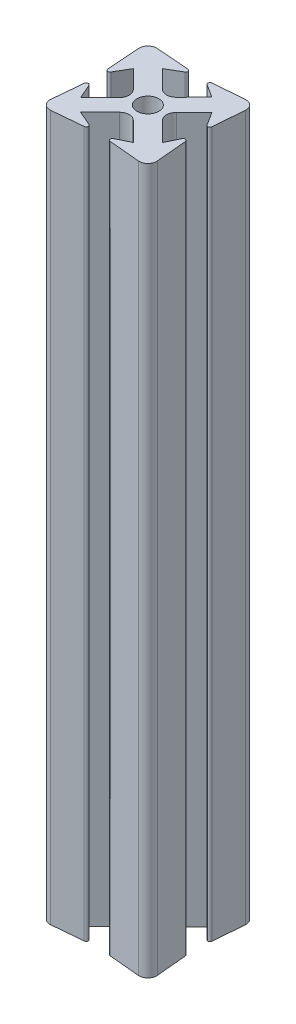
from build123d import *

# Parameters (mm, degrees)
BOSS_EXTRUDE1_DEPTH     = 603.25
SKETCH8_R               = 2.565266714
CUT_EXTRUDE4_DEPTH      = 604.996
FILLET1_R               = 2.032
FILLET2_R               = 0.508
SKETCH5_W               = 12.655737404
SKETCH5_H               = 275.477439744
BOSS_EXTRUDE3_DEPTH     = 4.572
SKETCH6_R               = 4.617709461
SKETCH6_R_2             = 4.503643825
SKETCH6_R_3             = 4.621904919
SKETCH6_R_4             = 4.672748293
SKETCH6_R_5             = 4.615964847
CUT_EXTRUDE2_DEPTH      = 4.572
SKETCH7_R               = 4.54487388
SKETCH7_R_2             = 4.672668652
CUT_EXTRUDE3_DEPTH      = 4.572
FILLET3_R               = 2.286
CUT_EXTRUDE6_DEPTH      = 10.922
CUT_EXTRUDE6_DEPTH_BACK = 38.354
SKETCH9_W               = 60.400846089
SKETCH9_H               = 376.70446786
CUT_EXTRUDE7_DEPTH      = 11.938
CUT_EXTRUDE7_DEPTH_BACK = 33.274
SKETCH10_W              = 57.705662998
SKETCH10_H              = 86.678631682


with BuildPart() as part:
    # Sketch2 → Boss-Extrude1 (new body)
    with BuildSketch(Plane(origin=(0, 0, 0), x_dir=(1, 0, 0), z_dir=(0, 1, 0))):
        Polygon((-16.258611825, -14.593573265), (-15.211300169, -2.97584616), (-12.901409331, -8.316313776), (2.370242199, 7.164742979), (-1.981461576, 9.939777323), (9.141388175, 10.806426735), (8.274738763, -0.316423015), (5.499704418, 4.03528076), (-9.981352337, -11.236370771), (-4.640884721, -13.546261608), align=None)
        Polygon((-15.391962413, -0.962649654), (-12.616928069, 3.750799497), (2.370242199, -11.236370771), (-2.346798037, -13.546261608), (9.141388175, -14.593573265), (8.094076519, -3.105387053), (5.784185681, -7.822427289), (-9.202984587, 7.164742979), (-4.489535436, 9.939777323), (-16.258611825, 10.806426735), align=None)
    extrude(amount=BOSS_EXTRUDE1_DEPTH)

    # Sketch8 → Cut-Extrude4 (cut)
    with BuildSketch(Plane(origin=(0, 603.25, 0), x_dir=(1, 0, 0), z_dir=(0, 1, 0))):
        with Locations(Location((-3.527048706, -1.915222876, 0), (0, 0, 270))):
            Circle(SKETCH8_R)
    extrude(amount=-CUT_EXTRUDE4_DEPTH, mode=Mode.SUBTRACT)

    # Fillet1
    fillet1_edges = [part.edges().sort_by_distance(p)[0] for p in [
        (9.141388175, 301.625, -10.806426735),
        (9.141388175, 301.625, 14.593573265),
        (-16.258611825, 301.625, 14.593573265),
        (-16.258611825, 301.625, -10.806426735),
    ]]
    fillet(fillet1_edges, radius=FILLET1_R)

    # Fillet2
    fillet2_edges = [part.edges().sort_by_distance(p)[0] for p in [
        (-1.981461576, 301.625, -9.939777323),
        (8.274738763, 301.625, 0.316423015),
        (8.094076519, 301.625, 3.105387053),
        (-2.346798037, 301.625, 13.546261608),
        (-4.640884721, 301.625, 13.546261608),
        (-15.211300169, 301.625, 2.97584616),
        (-15.391962413, 301.625, 0.962649654),
        (-4.489535436, 301.625, -9.939777323),
    ]]
    fillet(fillet2_edges, radius=FILLET2_R)

    # Sketch5 → Boss-Extrude3 (add)
    with BuildSketch(Plane(origin=(-0.781752329, 0, -10.033254025), x_dir=(-0.9969782897972478, 0, 0.07768069047681715), z_dir=(-0.07768069047681715, 0, -0.9969782897972478))):
        with Locations((2.46042797, 432.716085527)):
            Rectangle(SKETCH5_W, SKETCH5_H)
    extrude(amount=BOSS_EXTRUDE3_DEPTH)

    # Sketch6 → Cut-Extrude2 (cut)
    with BuildSketch(Plane(origin=(-1.136908446, 0, -14.591438766), x_dir=(-0.9969782897972478, 0, 0.07768069047681722), z_dir=(-0.07768069047681722, 0, -0.9969782897972478))):
        with Locations((2.46042797, 545.232588529)):
            Circle(SKETCH6_R)
        with Locations((2.46042797, 513.854170907)):
            Circle(SKETCH6_R_2)
        with Locations((2.46042797, 479.255100803)):
            Circle(SKETCH6_R_3)
        with Locations((2.46042797, 446.301604006)):
            Circle(SKETCH6_R_4)
        with Locations((2.46042797, 414.342225806)):
            Circle(SKETCH6_R_5)
    extrude(amount=-CUT_EXTRUDE2_DEPTH, mode=Mode.SUBTRACT)

    # Sketch7 → Cut-Extrude3 (cut)
    with BuildSketch(Plane(origin=(-1.136908446, 0, -14.591438766), x_dir=(-0.9969782897972478, 0, 0.07768069047681712), z_dir=(-0.07768069047681712, 0, -0.9969782897972478))):
        with Locations((2.610241648, 377.377881706)):
            Circle(SKETCH7_R)
        with Locations((2.157369038, 338.135767483)):
            Circle(SKETCH7_R_2)
    extrude(amount=-CUT_EXTRUDE3_DEPTH, mode=Mode.SUBTRACT)

    # Fillet3
    fillet3_edges = [part.edges().sort_by_distance(p)[0] for p in [
        (-0.326311914, 301.625, 1.711929695),
        (-6.767665082, 301.625, 2.09846349),
        (-3.376968255, 301.625, -1.338726647),
        (-3.76350205, 301.625, 5.102626521),
    ]]
    fillet(fillet3_edges, radius=FILLET3_R)

    # Sketch9 → Cut-Extrude6 (cut, two sides: drawn at the far end of the back side and taken through both)
    with BuildSketch(Plane(origin=(-14.822577076, 0, -1.336221587), x_dir=(-0.08978364374222932, 0, 0.995961293081397), z_dir=(-0.9959612930813971, 0, -0.08978364374222933)).offset(-CUT_EXTRUDE6_DEPTH_BACK)):
        with Locations((4.674775329, 432.715581258)):
            Rectangle(SKETCH9_W, SKETCH9_H)
    extrude(amount=CUT_EXTRUDE6_DEPTH + CUT_EXTRUDE6_DEPTH_BACK, mode=Mode.SUBTRACT)

    # Sketch10 → Cut-Extrude7 (cut, two sides: drawn at the far end of the back side and taken through both)
    with BuildSketch(Plane(origin=(7.74659499, 0, -0.706212372), x_dir=(-0.09078774644161682, 0, -0.9958702651932394), z_dir=(0.9958702651932394, 0, -0.09078774644161682)).offset(-CUT_EXTRUDE7_DEPTH_BACK)):
        with Locations((-4.603685072, 208.51404869)):
            Rectangle(SKETCH10_W, SKETCH10_H)
    extrude(amount=CUT_EXTRUDE7_DEPTH + CUT_EXTRUDE7_DEPTH_BACK, mode=Mode.SUBTRACT)


solid = part.part
